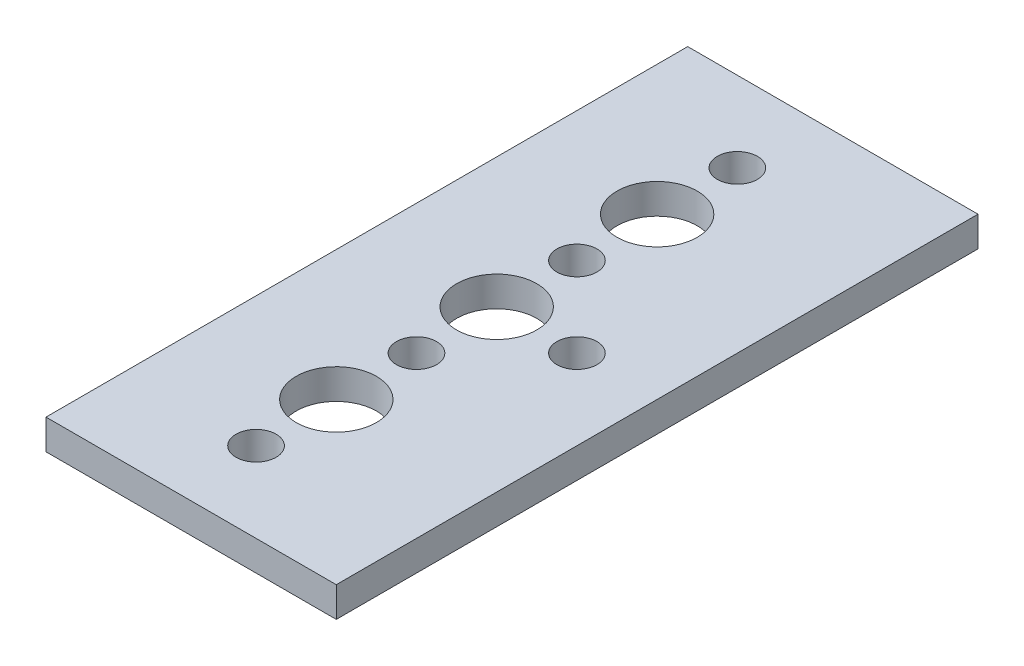
from build123d import *

# Parameters (mm, degrees)
SKETCH1_W           = 28.95
SKETCH1_H           = 64
SKETCH1_R           = 4
SKETCH1_R_2         = 2
BOSS_EXTRUDE1_DEPTH = 3


with BuildPart() as part:
    # Sketch1 → Boss-Extrude1 (new body)
    with BuildSketch(Plane(origin=(0, 0, 0), x_dir=(1, 0, 0), z_dir=(0, 1, 0))):
        with Locations((1.525, 0)):
            Rectangle(SKETCH1_W, SKETCH1_H)
        with Locations(Location((0, 0, 0), (0, 0, 270))):
            Circle(SKETCH1_R, mode=Mode.SUBTRACT)
        with Locations(Location((0, 8, 0), (0, 0, 270))):
            Circle(SKETCH1_R_2, mode=Mode.SUBTRACT)
        with Locations(Location((8, 0, 0), (0, 0, 270))):
            Circle(SKETCH1_R_2, mode=Mode.SUBTRACT)
        with Locations(Location((0, -8, 0), (0, 0, 270))):
            Circle(SKETCH1_R_2, mode=Mode.SUBTRACT)
        with Locations(Location((0, 16, 0), (0, 0, 270))):
            Circle(SKETCH1_R, mode=Mode.SUBTRACT)
        with Locations(Location((0, 24, 0), (0, 0, 270))):
            Circle(SKETCH1_R_2, mode=Mode.SUBTRACT)
        with Locations(Location((0, -24, 0), (0, 0, 90))):
            Circle(SKETCH1_R_2, mode=Mode.SUBTRACT)
        with Locations(Location((0, -16, 0), (0, 0, 90))):
            Circle(SKETCH1_R, mode=Mode.SUBTRACT)
    extrude(amount=BOSS_EXTRUDE1_DEPTH)


solid = part.part
